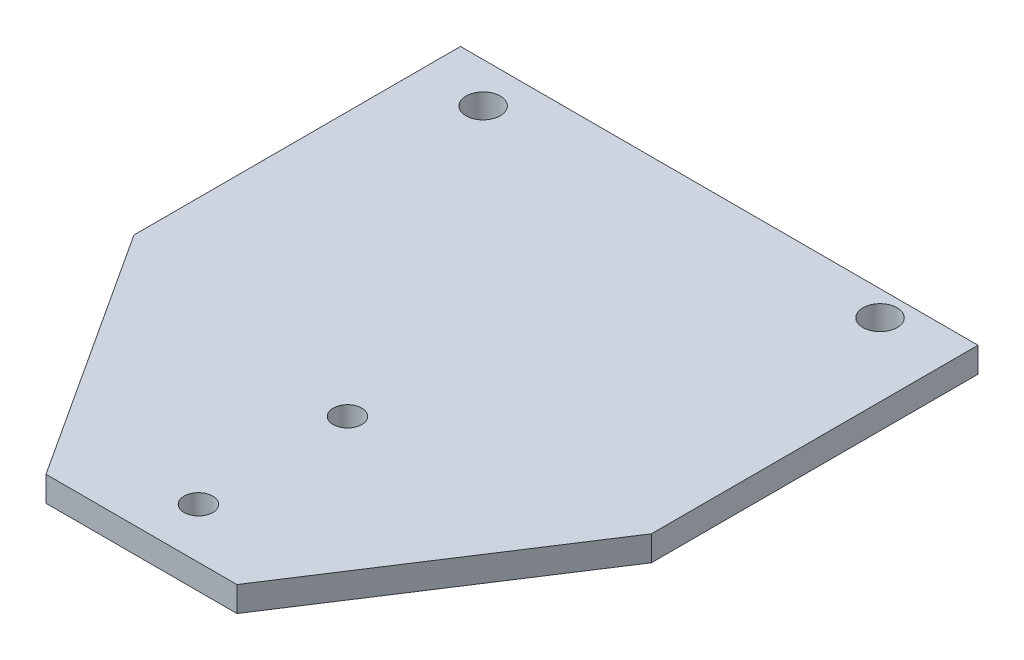
from build123d import *

# Parameters (mm, degrees)
SKETCH1_R               = 3.415098232
SKETCH1_R_2             = 3.415
BOSS_EXTRUDE1_DEPTH     = 5
CUT_EXTRUDE1_DEPTH      = 122.897497923
CUT_EXTRUDE1_DEPTH_BACK = 122.897497923
SKETCH2_R               = 2.85


with BuildPart() as part:
    # Sketch1 → Boss-Extrude1 (new body)
    with BuildSketch(Plane(origin=(0, 0, 0), x_dir=(1, 0, 0), z_dir=(0, 1, 0))):
        Polygon((0, 0), (0, 65), (103, 65), (103, 0), (70.5, -50), (32.5, -50), align=None)
        with Locations(Location((88.5, 60, 0), (0, 0, 270))):
            Circle(SKETCH1_R, mode=Mode.SUBTRACT)
        with Locations(Location((12.5, 57, 0), (0, 0, 270))):
            Circle(SKETCH1_R_2, mode=Mode.SUBTRACT)
    extrude(amount=BOSS_EXTRUDE1_DEPTH)

    # Sketch2 → Cut-Extrude1 (cut, two sides: drawn at the far end of the back side and taken through both)
    with BuildSketch(Plane(origin=(0, 5, 0), x_dir=(1, 0, 0), z_dir=(0, 1, 0)).offset(-CUT_EXTRUDE1_DEPTH_BACK)):
        with Locations(Location((52.841163777, -40, 0), (0, 0, 270))):
            Circle(SKETCH2_R)
        with Locations(Location((52.511369406, -10, 0), (0, 0, 270))):
            Circle(SKETCH2_R)
    extrude(amount=CUT_EXTRUDE1_DEPTH + CUT_EXTRUDE1_DEPTH_BACK, mode=Mode.SUBTRACT)


solid = part.part
